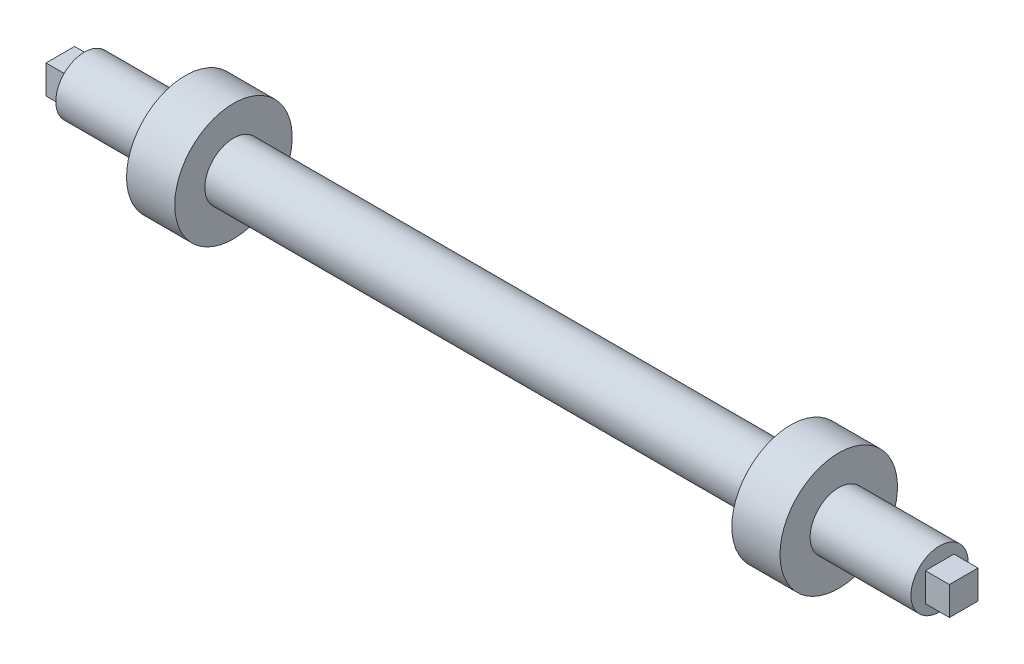
from build123d import *

# Parameters (mm, degrees)
ESQUISSE5_W        = 4.75
ESQUISSE5_H        = 4.75
BOSS_EXTRU_3_DEPTH = 4
BOSS_EXTRU_4_DEPTH = 4


with BuildPart() as part:
    # Esquisse1 → Révolution1 (revolve)
    with BuildSketch(Plane(origin=(0, 0, 0), x_dir=(1, 0, 0), z_dir=(0, 1, 0))):
        Polygon((0, 0), (0, 4.75), (142, 4.75), (142, 0), (125.25, 0), (125.25, -5), (117.25, -5), (117.25, 0), (24.75, 0), (24.75, -5), (16.75, -5), (16.75, 0), align=None)
    revolve(axis=Axis((0, 0, -4.75), (1, 0, 0)))

    # Esquisse5 → Boss.-Extru.3 (add)
    with BuildSketch(Plane(origin=(142, 0, 0), x_dir=(0, 0, -1), z_dir=(1, 0, 0))):
        with Locations((4.75, 0)):
            Rectangle(ESQUISSE5_W, ESQUISSE5_H)
    extrude(amount=BOSS_EXTRU_3_DEPTH)

    # Esquisse6 → Boss.-Extru.4 (add)
    with BuildSketch(Plane.ZY):
        Polygon((-4.75, 2.375), (-7.125, 2.375), (-7.125, -2.375), (-2.375, -2.375), (-2.375, 2.375), align=None)
    extrude(amount=BOSS_EXTRU_4_DEPTH)


solid = part.part
